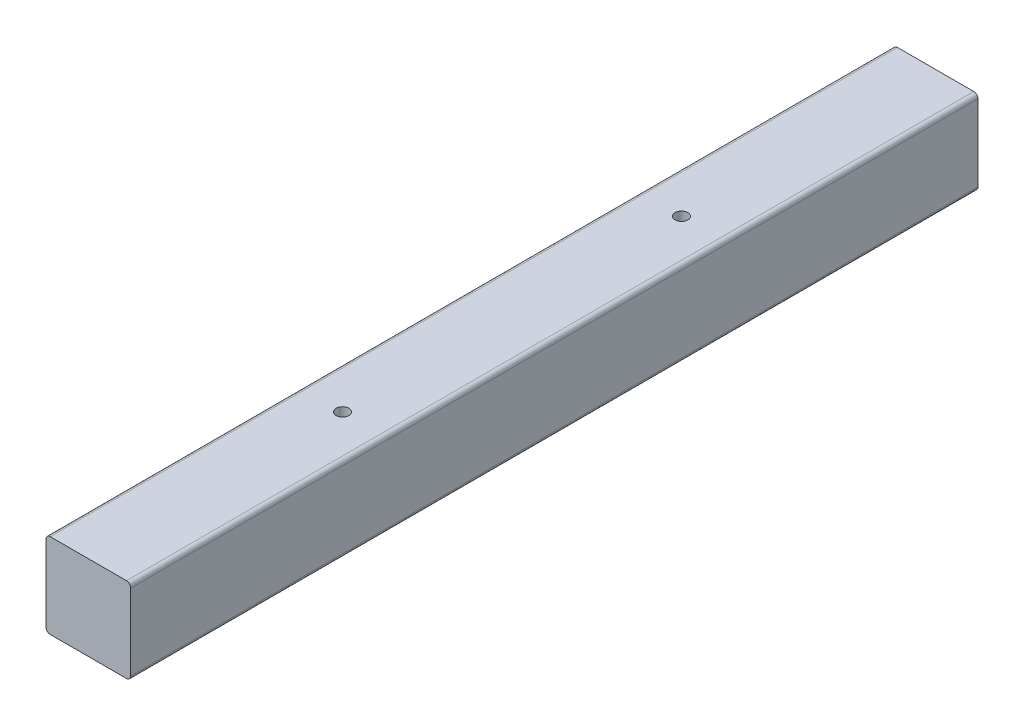
from build123d import *

# Parameters (mm, degrees)
SKETCH_1_W          = 20
SKETCH_1_H          = 20
EXTRUDE_1_DEPTH     = 100
FILLET_1_R          = 1
CUT_EXTRUDE_1_REACH = 104.47
SKETCH_2_R          = 1.5


with BuildPart() as part:
    # ｽｹｯﾁ1 → ﾎﾞｽ - 押し出し1 (new, symmetric)
    with BuildSketch(Plane.XY):
        Rectangle(SKETCH_1_W, SKETCH_1_H)
    extrude(amount=EXTRUDE_1_DEPTH, both=True)

    # ﾌｨﾚｯﾄ1
    fillet_1_edges = [part.edges().sort_by_distance(p)[0] for p in [
        (-10, 10, 0),
        (10, 10, 0),
        (10, -10, 0),
        (-10, -10, 0),
    ]]
    fillet(fillet_1_edges, radius=FILLET_1_R)

    # ｽｹｯﾁ2 → ｶｯﾄ - 押し出し1 (cut, up to next)
    with BuildSketch(Plane(origin=(0, 10, 0), x_dir=(1, 0, 0), z_dir=(0, 1, 0)), mode=Mode.PRIVATE) as cut_extrude_1_sk1:
        with Locations(Location((0, 40, 0), (0, 0, 180))):
            Circle(SKETCH_2_R)
    cut_extrude_1_tool1 = extrude(cut_extrude_1_sk1.sketch, amount=-CUT_EXTRUDE_1_REACH, mode=Mode.PRIVATE) & part.part
    # ｽｹｯﾁ2 → ｶｯﾄ - 押し出し1 (cut, up to next)
    with BuildSketch(Plane(origin=(0, 10, 0), x_dir=(1, 0, 0), z_dir=(0, 1, 0)), mode=Mode.PRIVATE) as cut_extrude_1_sk2:
        with Locations(Location((0, -40, 0), (0, 0, 180))):
            Circle(SKETCH_2_R)
    cut_extrude_1_tool2 = extrude(cut_extrude_1_sk2.sketch, amount=-CUT_EXTRUDE_1_REACH, mode=Mode.PRIVATE) & part.part
    add(cut_extrude_1_tool1.solids().sort_by_distance((0, 10, -40))[0], mode=Mode.SUBTRACT)
    add(cut_extrude_1_tool2.solids().sort_by_distance((0, 10, 40))[0], mode=Mode.SUBTRACT)


solid = part.part
